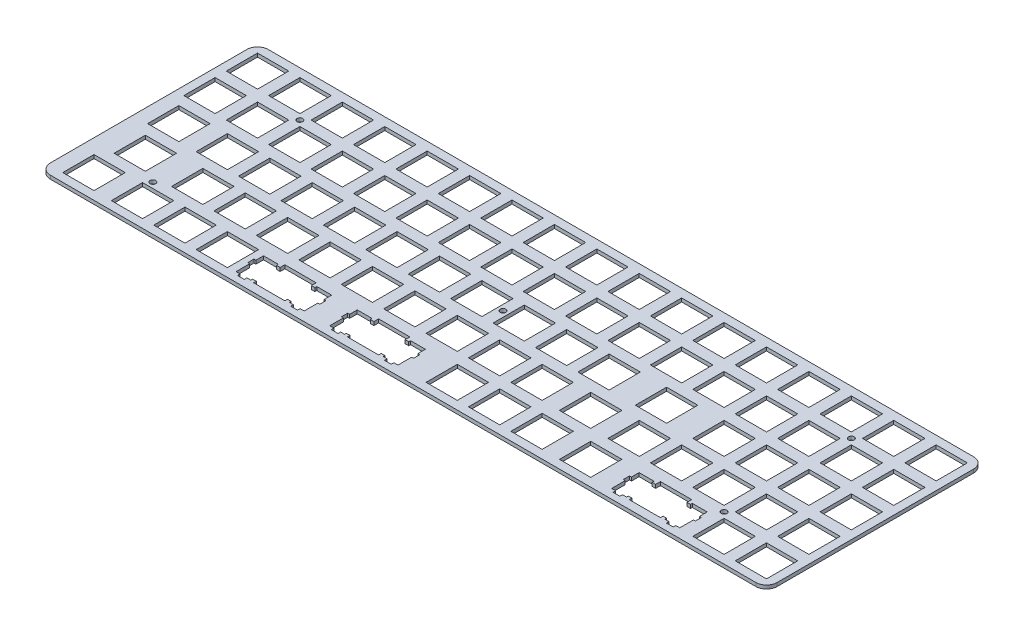
from build123d import *

# Parameters (mm, degrees)
SKETCH2_R           = 1.27
SKETCH2_W           = 13.9954
SKETCH2_H           = 13.9954
SKETCH2_W_2         = 13.995399999
SKETCH2_W_3         = 13.995400001
BOSS_EXTRUDE1_DEPTH = 0.79375


with BuildPart() as part:
    # Sketch2 → Boss-Extrude1 (new, symmetric)
    with BuildSketch(Plane(origin=(0, 0, 0), x_dir=(1, 0, 0), z_dir=(0, 1, 0))):
        with BuildLine():
            Line((323.778001668, -72.015500368), (323.778001668, 16.0155001))
            ThreePointArc((323.778001668, 16.0155001), (322.383097713, 19.383096145), (319.015501668, 20.7780001))
            Line((319.015501668, 20.7780001), (2.9845, 20.7780001))
            ThreePointArc((2.9845, 20.7780001), (-0.383096045, 19.383096145), (-1.778, 16.0155001))
            Line((-1.778, 16.0155001), (-1.778, -72.015500368))
            ThreePointArc((-1.778, -72.015500368), (-0.383096045, -75.383096413), (2.9845, -76.778000368))
            Line((2.9845, -76.778000368), (319.015501668, -76.778000368))
            ThreePointArc((319.015501668, -76.778000368), (322.383097713, -75.383096413), (323.778001668, -72.015500368))
        make_face()
        with Locations(Location((157.000000833, -28.000000134, 0), (0, 0, 270))):
            Circle(SKETCH2_R, mode=Mode.SUBTRACT)
        with Locations(Location((37.500000034, 0.500000067, 0), (0, 0, 270))):
            Circle(SKETCH2_R, mode=Mode.SUBTRACT)
        with Locations(Location((284.500000034, 0.500000067, 0), (0, 0, 270))):
            Circle(SKETCH2_R, mode=Mode.SUBTRACT)
        with Locations(Location((284.500001484, -56.500000284, 0), (0, 0, 270))):
            Circle(SKETCH2_R, mode=Mode.SUBTRACT)
        with Locations(Location((28.625000121, -56.500000284, 0), (0, 0, 270))):
            Circle(SKETCH2_R, mode=Mode.SUBTRACT)
        Polygon((132.252300709, -59.002300334), (132.252300709, -61.123200334), (130.639400709, -61.123200334), (130.639400709, -60.310400334), (123.98460071, -60.310400334), (123.98460071, -63.714000334), (123.12100071, -63.714000334), (123.12100071, -66.508000334), (123.98460071, -66.508000334), (123.98460071, -72.604000334), (125.788000709, -72.604000334), (125.788000709, -73.772400334), (128.836000709, -73.772400334), (128.836000709, -72.604000334), (130.639400709, -72.604000334), (130.639400709, -71.816600334), (132.252300709, -71.816600334), (132.252300709, -72.997700334), (146.24770071, -72.997700334), (146.24770071, -71.816600334), (147.86060071, -71.816600334), (147.86060071, -72.604000334), (149.66400071, -72.604000334), (149.66400071, -73.772400334), (152.712000709, -73.772400334), (152.712000709, -72.604000334), (154.515400709, -72.604000334), (154.515400709, -66.508000334), (155.379000709, -66.508000334), (155.379000709, -63.714000334), (154.515400709, -63.714000334), (154.515400709, -60.310400334), (147.86060071, -60.310400334), (147.86060071, -61.123200334), (146.24770071, -61.123200334), (146.24770071, -59.002300334), align=None, mode=Mode.SUBTRACT)
        Polygon((81.984600509, -63.714000334), (81.121000508, -63.714000334), (81.121000508, -66.508000334), (81.984600509, -66.508000334), (81.984600509, -72.604000334), (83.788000509, -72.604000334), (83.788000509, -73.772400334), (86.836000508, -73.772400334), (86.836000508, -72.604000334), (88.639400509, -72.604000334), (88.639400509, -71.816600334), (90.252300508, -71.816600334), (90.252300508, -72.997700334), (104.247700509, -72.997700334), (104.247700509, -71.816600334), (105.860600508, -71.816600334), (105.860600508, -72.604000334), (107.664000509, -72.604000334), (107.664000509, -73.772400334), (110.712000508, -73.772400334), (110.712000508, -72.604000334), (112.515400509, -72.604000334), (112.515400509, -66.508000334), (113.379000508, -66.508000334), (113.379000508, -63.714000334), (112.515400509, -63.714000334), (112.515400509, -60.310400334), (105.860600508, -60.310400334), (105.860600508, -61.123200334), (104.247700509, -61.123200334), (104.247700509, -59.002300334), (90.252300508, -59.002300334), (90.252300508, -61.123200334), (88.639400509, -61.123200334), (88.639400509, -60.310400334), (81.984600509, -60.310400334), align=None, mode=Mode.SUBTRACT)
        Polygon((280.765401384, -60.310400334), (274.110601384, -60.310400334), (274.110601384, -61.123200334), (272.497701384, -61.123200334), (272.497701384, -59.002300334), (258.502301384, -59.002300334), (258.502301384, -61.123200334), (256.889401384, -61.123200334), (256.889401384, -60.310400334), (250.234601384, -60.310400334), (250.234601384, -63.714000334), (249.371001384, -63.714000334), (249.371001384, -66.508000334), (250.234601384, -66.508000334), (250.234601384, -72.604000334), (252.038001384, -72.604000334), (252.038001384, -73.772400334), (255.086001384, -73.772400334), (255.086001384, -72.604000334), (256.889401384, -72.604000334), (256.889401384, -71.816600334), (258.502301384, -71.816600334), (258.502301384, -72.997700334), (272.497701384, -72.997700334), (272.497701384, -71.816600334), (274.110601384, -71.816600334), (274.110601384, -72.604000334), (275.914001384, -72.604000334), (275.914001384, -73.772400334), (278.962001384, -73.772400334), (278.962001384, -72.604000334), (280.765401384, -72.604000334), (280.765401384, -66.508000334), (281.629001384, -66.508000334), (281.629001384, -63.714000334), (280.765401384, -63.714000334), align=None, mode=Mode.SUBTRACT)
        with Locations((47.000000033, 10.000000066)):
            Rectangle(SKETCH2_W, SKETCH2_H, mode=Mode.SUBTRACT)
        with Locations((9.000000034, 10.000000066)):
            Rectangle(SKETCH2_W, SKETCH2_H, mode=Mode.SUBTRACT)
        with Locations((28.000000035, 10.000000066)):
            Rectangle(SKETCH2_W, SKETCH2_H, mode=Mode.SUBTRACT)
        with Locations((313.000001634, -28.000000134)):
            Rectangle(SKETCH2_W, SKETCH2_H, mode=Mode.SUBTRACT)
        with Locations((313.000001634, -47.000000234)):
            Rectangle(SKETCH2_W, SKETCH2_H, mode=Mode.SUBTRACT)
        with Locations((212.500001085, -66.000000334)):
            Rectangle(SKETCH2_W, SKETCH2_H, mode=Mode.SUBTRACT)
        with Locations((294.000001534, -28.000000134)):
            Rectangle(SKETCH2_W, SKETCH2_H, mode=Mode.SUBTRACT)
        with Locations((117.500000585, -47.000000234)):
            Rectangle(SKETCH2_W, SKETCH2_H, mode=Mode.SUBTRACT)
        with Locations((294.000001534, -66.000000334)):
            Rectangle(SKETCH2_W, SKETCH2_H, mode=Mode.SUBTRACT)
        with Locations((185.500000983, -28.000000134)):
            Rectangle(SKETCH2_W, SKETCH2_H, mode=Mode.SUBTRACT)
        with Locations((313.000001634, -66.000000334)):
            Rectangle(SKETCH2_W, SKETCH2_H, mode=Mode.SUBTRACT)
        with Locations((294.000001534, -47.000000234)):
            Rectangle(SKETCH2_W, SKETCH2_H, mode=Mode.SUBTRACT)
        with Locations((275.000001434, -47.000000234)):
            Rectangle(SKETCH2_W, SKETCH2_H, mode=Mode.SUBTRACT)
        with Locations((275.000001434, -28.000000134)):
            Rectangle(SKETCH2_W, SKETCH2_H, mode=Mode.SUBTRACT)
        with Locations((174.500000885, -47.000000234)):
            Rectangle(SKETCH2_W, SKETCH2_H, mode=Mode.SUBTRACT)
        with Locations((256.000001334, -28.000000134)):
            Rectangle(SKETCH2_W, SKETCH2_H, mode=Mode.SUBTRACT)
        with Locations((193.500000985, -47.000000234)):
            Rectangle(SKETCH2_W, SKETCH2_H, mode=Mode.SUBTRACT)
        with Locations((128.500000683, -28.000000134)):
            Rectangle(SKETCH2_W, SKETCH2_H, mode=Mode.SUBTRACT)
        with Locations((193.500000985, -66.000000334)):
            Rectangle(SKETCH2_W, SKETCH2_H, mode=Mode.SUBTRACT)
        with Locations((155.500000785, -47.000000234)):
            Rectangle(SKETCH2_W, SKETCH2_H, mode=Mode.SUBTRACT)
        with Locations((256.000001334, -47.000000234)):
            Rectangle(SKETCH2_W, SKETCH2_H, mode=Mode.SUBTRACT)
        with Locations((136.500000685, -47.000000234)):
            Rectangle(SKETCH2_W, SKETCH2_H, mode=Mode.SUBTRACT)
        with Locations((11.750000058, -66.000000334)):
            Rectangle(SKETCH2_W_2, SKETCH2_H, mode=Mode.SUBTRACT)
        with Locations((237.000001234, -47.000000234)):
            Rectangle(SKETCH2_W, SKETCH2_H, mode=Mode.SUBTRACT)
        with Locations((52.500000283, -66.000000334)):
            Rectangle(SKETCH2_W, SKETCH2_H, mode=Mode.SUBTRACT)
        with Locations((147.500000783, -28.000000134)):
            Rectangle(SKETCH2_W, SKETCH2_H, mode=Mode.SUBTRACT)
        with Locations((52.500000283, -28.000000134)):
            Rectangle(SKETCH2_W, SKETCH2_H, mode=Mode.SUBTRACT)
        with Locations((90.500000483, -28.000000134)):
            Rectangle(SKETCH2_W, SKETCH2_H, mode=Mode.SUBTRACT)
        with Locations((230.250001208, -28.000000134)):
            Rectangle(SKETCH2_W, SKETCH2_H, mode=Mode.SUBTRACT)
        with Locations((204.500001083, -28.000000134)):
            Rectangle(SKETCH2_W, SKETCH2_H, mode=Mode.SUBTRACT)
        with Locations((71.500000383, -66.000000334)):
            Rectangle(SKETCH2_W, SKETCH2_H, mode=Mode.SUBTRACT)
        with Locations((79.500000385, -47.000000234)):
            Rectangle(SKETCH2_W, SKETCH2_H, mode=Mode.SUBTRACT)
        with Locations((166.500000883, -28.000000134)):
            Rectangle(SKETCH2_W, SKETCH2_H, mode=Mode.SUBTRACT)
        with Locations((41.500000185, -47.000000234)):
            Rectangle(SKETCH2_W, SKETCH2_H, mode=Mode.SUBTRACT)
        with Locations((215.25000111, -47.000000234)):
            Rectangle(SKETCH2_W_3, SKETCH2_H, mode=Mode.SUBTRACT)
        with Locations((15.750000059, -47.000000234)):
            Rectangle(SKETCH2_W, SKETCH2_H, mode=Mode.SUBTRACT)
        with Locations((104.000000034, -8.999999935)):
            Rectangle(SKETCH2_W, SKETCH2_H, mode=Mode.SUBTRACT)
        with Locations((174.500000885, -66.000000334)):
            Rectangle(SKETCH2_W, SKETCH2_H, mode=Mode.SUBTRACT)
        with Locations((161.000000034, -8.999999935)):
            Rectangle(SKETCH2_W, SKETCH2_H, mode=Mode.SUBTRACT)
        with Locations((33.500000183, -28.000000134)):
            Rectangle(SKETCH2_W, SKETCH2_H, mode=Mode.SUBTRACT)
        with Locations((98.500000485, -47.000000234)):
            Rectangle(SKETCH2_W, SKETCH2_H, mode=Mode.SUBTRACT)
        with Locations((60.500000285, -47.000000234)):
            Rectangle(SKETCH2_W, SKETCH2_H, mode=Mode.SUBTRACT)
        with Locations((234.250001209, -66.000000334)):
            Rectangle(SKETCH2_W_3, SKETCH2_H, mode=Mode.SUBTRACT)
        with Locations((275.000000034, -8.999999935)):
            Rectangle(SKETCH2_W, SKETCH2_H, mode=Mode.SUBTRACT)
        with Locations((33.500000183, -66.000000334)):
            Rectangle(SKETCH2_W, SKETCH2_H, mode=Mode.SUBTRACT)
        with Locations((71.500000383, -28.000000134)):
            Rectangle(SKETCH2_W, SKETCH2_H, mode=Mode.SUBTRACT)
        with Locations((109.500000583, -28.000000134)):
            Rectangle(SKETCH2_W, SKETCH2_H, mode=Mode.SUBTRACT)
        with Locations((199.000000033, -8.999999935)):
            Rectangle(SKETCH2_W, SKETCH2_H, mode=Mode.SUBTRACT)
        with Locations((85.000000035, -8.999999935)):
            Rectangle(SKETCH2_W, SKETCH2_H, mode=Mode.SUBTRACT)
        with Locations((66.000000034, -8.999999935)):
            Rectangle(SKETCH2_W, SKETCH2_H, mode=Mode.SUBTRACT)
        with Locations((218.000000034, -8.999999935)):
            Rectangle(SKETCH2_W, SKETCH2_H, mode=Mode.SUBTRACT)
        with Locations((294.000000033, -8.999999935)):
            Rectangle(SKETCH2_W, SKETCH2_H, mode=Mode.SUBTRACT)
        with Locations((142.000000033, -8.999999935)):
            Rectangle(SKETCH2_W, SKETCH2_H, mode=Mode.SUBTRACT)
        with Locations((180.000000035, -8.999999935)):
            Rectangle(SKETCH2_W, SKETCH2_H, mode=Mode.SUBTRACT)
        with Locations((313.000000034, -8.999999935)):
            Rectangle(SKETCH2_W, SKETCH2_H, mode=Mode.SUBTRACT)
        with Locations((85.000000035, 10.000000066)):
            Rectangle(SKETCH2_W, SKETCH2_H, mode=Mode.SUBTRACT)
        with Locations((9.000000034, -8.999999935)):
            Rectangle(SKETCH2_W, SKETCH2_H, mode=Mode.SUBTRACT)
        with Locations((237.000000035, -8.999999935)):
            Rectangle(SKETCH2_W, SKETCH2_H, mode=Mode.SUBTRACT)
        with Locations((123.000000035, 10.000000066)):
            Rectangle(SKETCH2_W, SKETCH2_H, mode=Mode.SUBTRACT)
        with Locations((256.000000034, 10.000000066)):
            Rectangle(SKETCH2_W, SKETCH2_H, mode=Mode.SUBTRACT)
        with Locations((123.000000035, -8.999999935)):
            Rectangle(SKETCH2_W, SKETCH2_H, mode=Mode.SUBTRACT)
        with Locations((256.000000034, -8.999999935)):
            Rectangle(SKETCH2_W, SKETCH2_H, mode=Mode.SUBTRACT)
        with Locations((66.000000034, 10.000000066)):
            Rectangle(SKETCH2_W, SKETCH2_H, mode=Mode.SUBTRACT)
        with Locations((313.000000034, 10.000000066)):
            Rectangle(SKETCH2_W, SKETCH2_H, mode=Mode.SUBTRACT)
        with Locations((28.000000035, -8.999999935)):
            Rectangle(SKETCH2_W, SKETCH2_H, mode=Mode.SUBTRACT)
        with Locations((161.000000034, 10.000000066)):
            Rectangle(SKETCH2_W, SKETCH2_H, mode=Mode.SUBTRACT)
        with Locations((199.000000033, 10.000000066)):
            Rectangle(SKETCH2_W, SKETCH2_H, mode=Mode.SUBTRACT)
        with Locations((218.000000034, 10.000000066)):
            Rectangle(SKETCH2_W, SKETCH2_H, mode=Mode.SUBTRACT)
        with Locations((294.000000033, 10.000000066)):
            Rectangle(SKETCH2_W, SKETCH2_H, mode=Mode.SUBTRACT)
        with Locations((142.000000033, 10.000000066)):
            Rectangle(SKETCH2_W, SKETCH2_H, mode=Mode.SUBTRACT)
        with Locations((180.000000035, 10.000000066)):
            Rectangle(SKETCH2_W, SKETCH2_H, mode=Mode.SUBTRACT)
        with Locations((275.000000034, 10.000000066)):
            Rectangle(SKETCH2_W, SKETCH2_H, mode=Mode.SUBTRACT)
        with Locations((104.000000034, 10.000000066)):
            Rectangle(SKETCH2_W, SKETCH2_H, mode=Mode.SUBTRACT)
        with Locations((47.000000033, -8.999999935)):
            Rectangle(SKETCH2_W, SKETCH2_H, mode=Mode.SUBTRACT)
        with Locations((237.000000035, 10.000000066)):
            Rectangle(SKETCH2_W, SKETCH2_H, mode=Mode.SUBTRACT)
        with Locations((11.750000058, -28.000000134)):
            Rectangle(SKETCH2_W_2, SKETCH2_H, mode=Mode.SUBTRACT)
    extrude(amount=BOSS_EXTRUDE1_DEPTH, both=True)


solid = part.part
